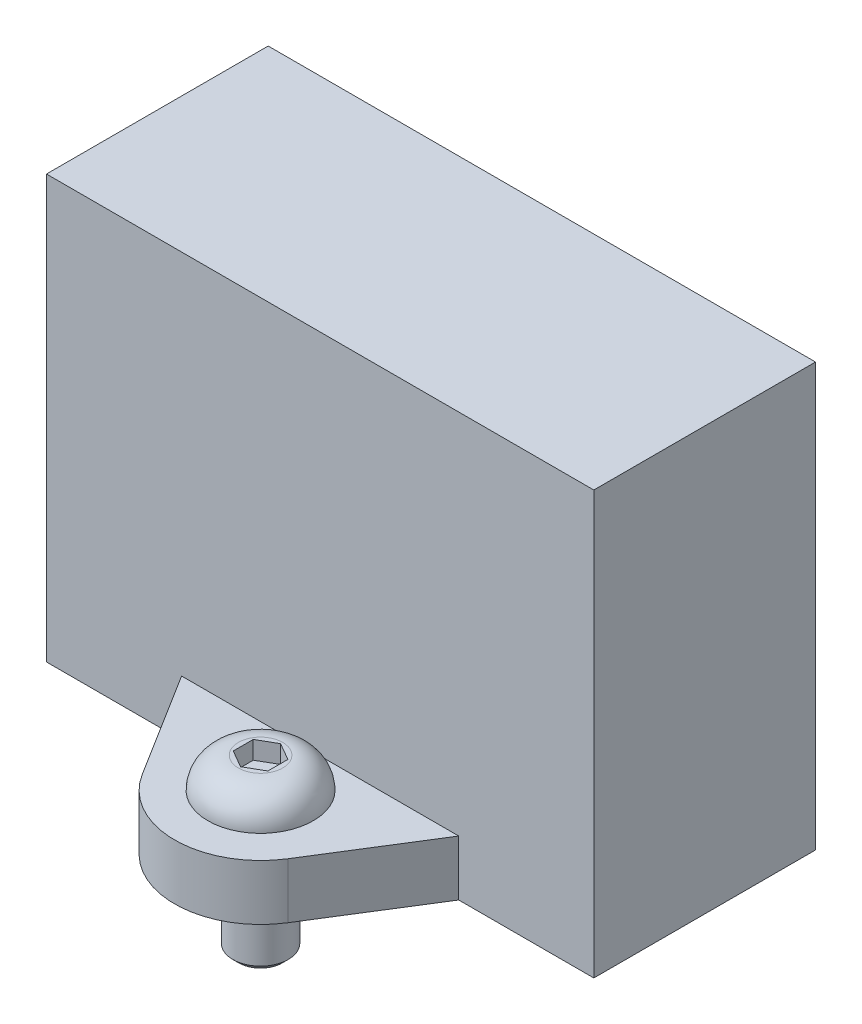
from build123d import *

# Parameters (mm, degrees)
SKETCH_1_W          = 39.5
SKETCH_1_H          = 16
EXTRUDE_1_DEPTH     = 30.5
EXTRUDE_2_DEPTH     = 4
SKETCH_3_W          = 2.15
SKETCH_3_H          = 4
CUT_EXTRUDE_1_DEPTH = 1.3


with BuildPart() as part:
    # 草图1 → 凸台-拉伸1 (new body)
    with BuildSketch(Plane(origin=(0, 0, 0), x_dir=(1, 0, 0), z_dir=(0, 1, 0))):
        with Locations((0, 8)):
            Rectangle(SKETCH_1_W, SKETCH_1_H)
    extrude(amount=EXTRUDE_1_DEPTH)

    # 草图2 → 凸台-拉伸2 (add)
    with BuildSketch(Plane(origin=(0, 0, 0), x_dir=(1, 0, 0), z_dir=(0, 1, 0))):
        with BuildLine():
            Line((-10, 0), (-5.257226723, -7.586573775))
            ThreePointArc((-5.257226723, -7.586573775), (0, -10.5), (5.257226723, -7.586573775))
            Line((5.257226723, -7.586573775), (10, 0))
            Line((10, 0), (-10, 0))
        make_face()
    extrude(amount=EXTRUDE_2_DEPTH)

    # 草图3 → 切除-旋转1 (revolve, cut)
    with BuildSketch(Plane.XY.offset(4.3)):
        with Locations((1.075, 2)):
            Rectangle(SKETCH_3_W, SKETCH_3_H)
    revolve(axis=Axis((0, 0, 4.3), (0, 1, 0)), mode=Mode.SUBTRACT)

    # 草图4 → 旋转1 (revolve)
    with BuildSketch(Plane.XY.offset(4.3)):
        with BuildLine():
            Line((0, 6.2), (1.6, 6.2))
            ThreePointArc((1.6, 6.2), (3.155634919, 5.555634919), (3.8, 4))
            Line((3.8, 4), (2, 4))
            Line((2, 4), (2, -5.5705))
            Line((2, -5.5705), (1.5705, -6))
            Line((1.5705, -6), (0, -6))
            Line((0, -6), (0, 6.2))
        make_face()
    revolve(axis=Axis((0, -6, 4.3), (0, 1, 0)))

    # 草图5 → 切除-拉伸1 (cut)
    with BuildSketch(Plane(origin=(0, 6.2, 0), x_dir=(1, 0, 0), z_dir=(0, 1, 0))):
        Polygon((-1.25, -3.578312164), (-1.25, -5.021687836), (0, -5.743375673), (1.25, -5.021687836), (1.25, -3.578312164), (0, -2.856624327), align=None)
    extrude(amount=-CUT_EXTRUDE_1_DEPTH, mode=Mode.SUBTRACT)


solid = part.part
